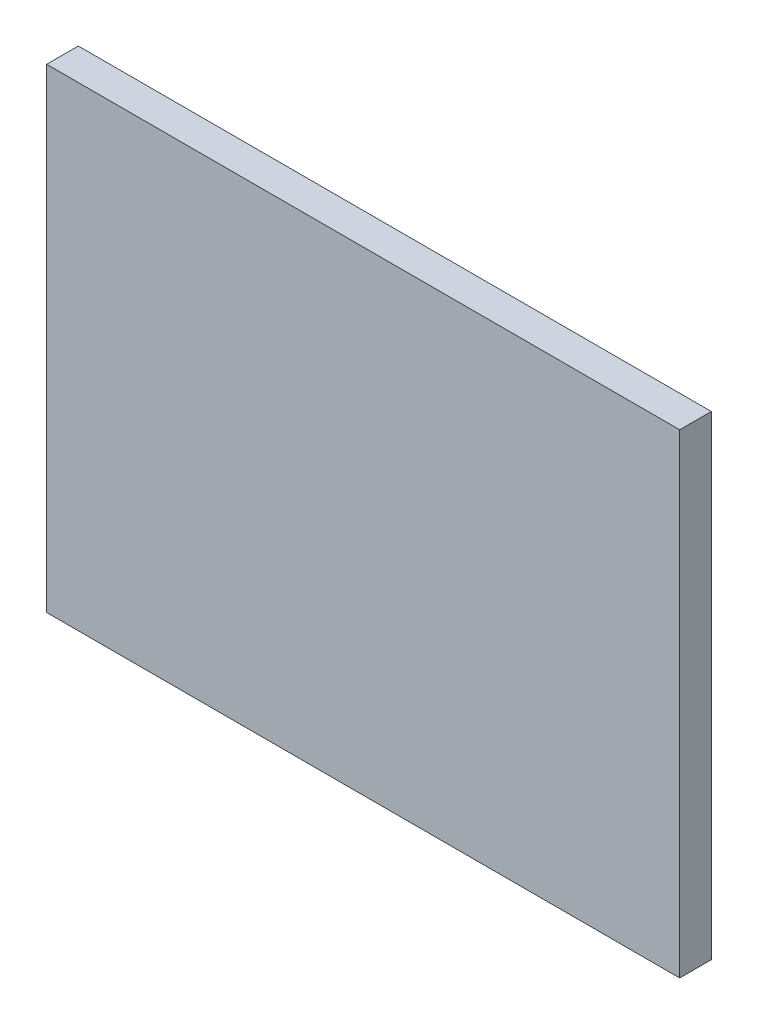
from build123d import *

# Parameters (mm, degrees)
SKIZZE1_W                       = 200
SKIZZE1_H                       = 150
AUFSATZ_LINEAR_AUSTRAGEN1_DEPTH = 10
SKIZZE2_R                       = 2.5
AUFSATZ_LINEAR_AUSTRAGEN2_DEPTH = 10


with BuildPart() as part:
    # Skizze1 → Aufsatz-Linear austragen1 (new body)
    with BuildSketch(Plane.XY):
        Rectangle(SKIZZE1_W, SKIZZE1_H)
    extrude(amount=AUFSATZ_LINEAR_AUSTRAGEN1_DEPTH)

    # Skizze2 → Aufsatz-Linear austragen2 (add)
    with BuildSketch(Plane(origin=(0, 0, 0), x_dir=(-1, 0, 0), z_dir=(0, 0, -1))):
        with Locations(Location((0, 0, 0), (0, 0, 180))):
            Circle(SKIZZE2_R)
        with Locations(Location((28, 0, 0), (0, 0, 180))):
            Circle(SKIZZE2_R)
    extrude(amount=AUFSATZ_LINEAR_AUSTRAGEN2_DEPTH)


solid = part.part
